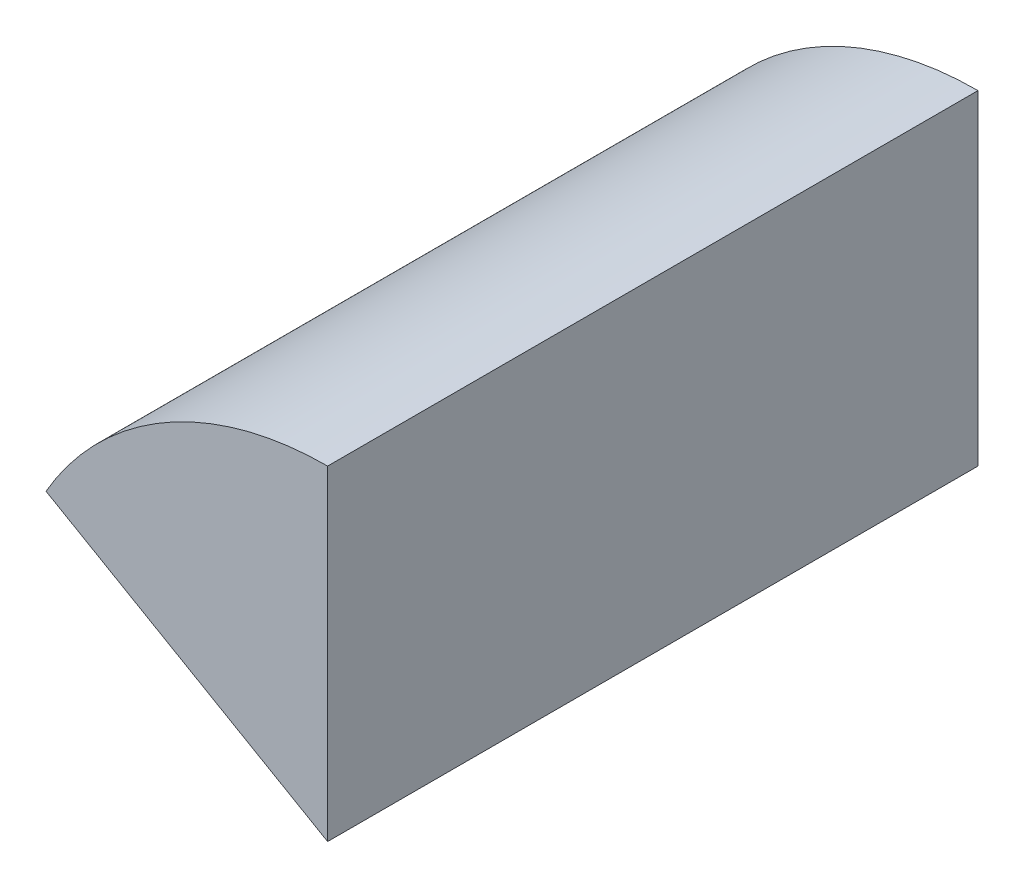
from build123d import *

# Parameters (mm, degrees)
SALIENTE_EXTRUIR1_DEPTH = 50
CROQUIS2_R              = 5
CORTAR_EXTRUIR1_DEPTH   = 10


with BuildPart() as part:
    # Croquis1 → Saliente-Extruir1 (new body)
    with BuildSketch(Plane.XY):
        with BuildLine():
            Line((0, 25), (0, 0))
            Line((0, 0), (-21.650635095, 12.5))
            ThreePointArc((-21.650635095, 12.5), (-12.5, 21.650635095), (0, 25))
        make_face()
    extrude(amount=SALIENTE_EXTRUIR1_DEPTH)

    # Croquis2 → Cortar-Extruir1 (cut)
    with BuildSketch(Plane(origin=(0, 0, 0), x_dir=(-1, 0, 0), z_dir=(0, 0, -1))):
        with Locations((7.782067737, 14.040645217)):
            Circle(CROQUIS2_R)
    extrude(amount=-CORTAR_EXTRUIR1_DEPTH, mode=Mode.SUBTRACT)


solid = part.part
